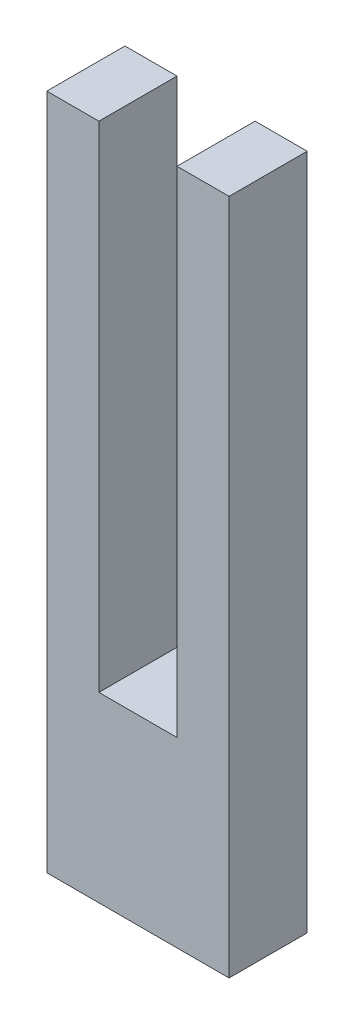
from build123d import *

# Parameters (mm, degrees)
SALIENTE_EXTRUIR1_DEPTH = 3


with BuildPart() as part:
    # Croquis1 → Saliente-Extruir1 (new body)
    with BuildSketch(Plane.XY):
        Polygon((0, 0), (7, 0), (7, 26), (5, 26), (5, 7), (2, 7), (2, 26), (0, 26), align=None)
    extrude(amount=SALIENTE_EXTRUIR1_DEPTH)


solid = part.part
